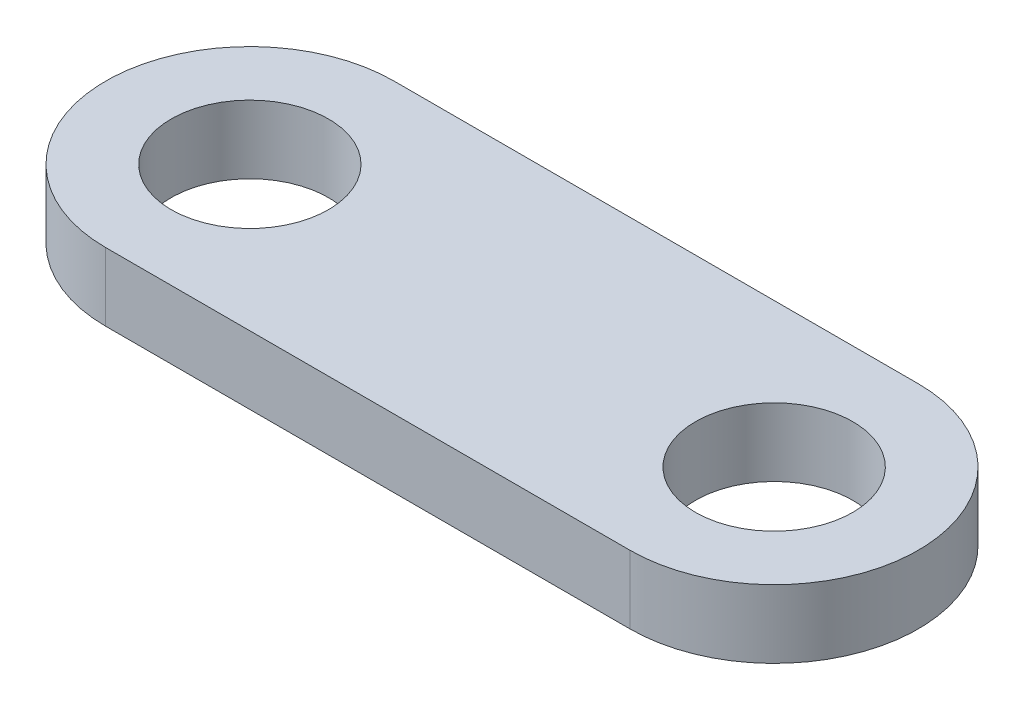
from build123d import *

# Parameters (mm, degrees)
SKETCH_1_R      = 3
EXTRUDE_1_DEPTH = 2.6


with BuildPart() as part:
    # 草图1 → 凸台-拉伸1 (new body)
    with BuildSketch(Plane(origin=(0, 0, 0), x_dir=(1, 0, 0), z_dir=(0, 1, 0))):
        with BuildLine():
            Line((-10, 5.5), (10, 5.5))
            ThreePointArc((10, 5.5), (15.5, 0), (10, -5.5))
            Line((10, -5.5), (-10, -5.5))
            ThreePointArc((-10, -5.5), (-15.5, 0), (-10, 5.5))
        make_face()
        with Locations(Location((-10, 0, 0), (0, 0, 270))):
            Circle(SKETCH_1_R, mode=Mode.SUBTRACT)
        with Locations(Location((10, 0, 0), (0, 0, 270))):
            Circle(SKETCH_1_R, mode=Mode.SUBTRACT)
    extrude(amount=EXTRUDE_1_DEPTH)


solid = part.part
